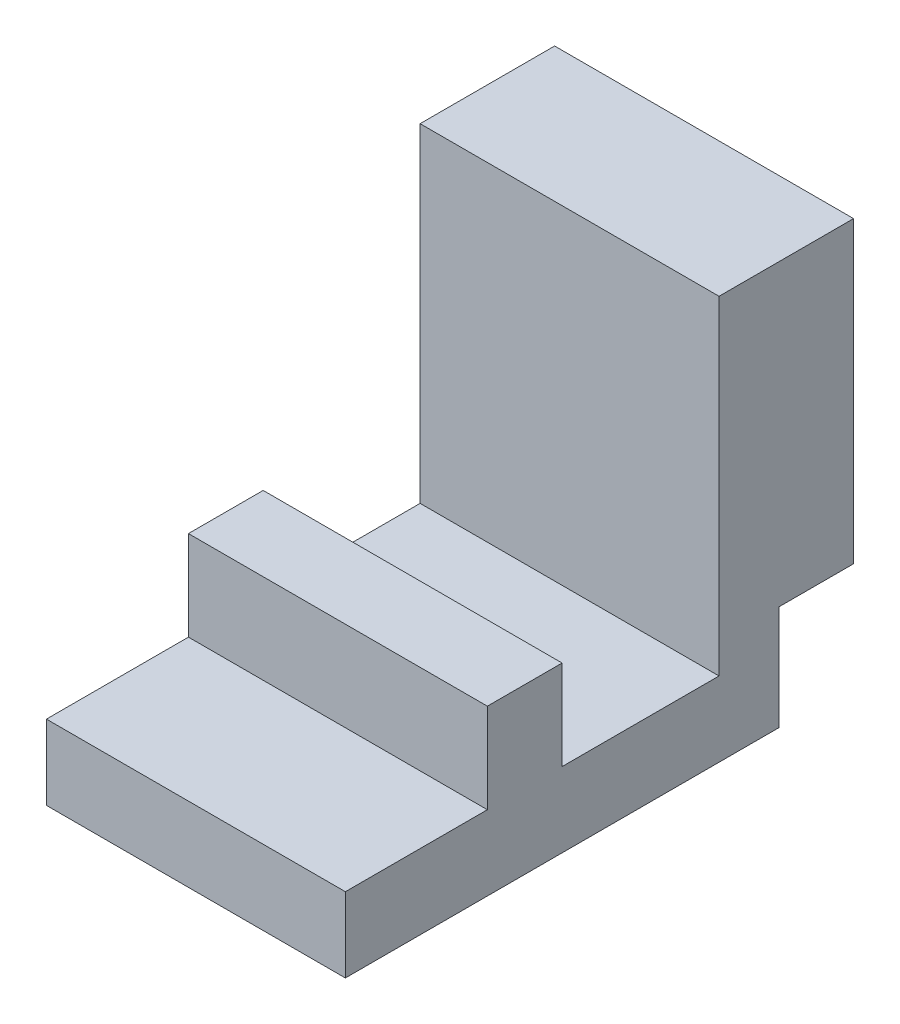
from build123d import *

# Parameters (mm, degrees)
SALIENTE_EXTRUIR2_DEPTH = 20


with BuildPart() as part:
    # Croquis1 → Saliente-Extruir2 (new, symmetric)
    with BuildSketch(Plane(origin=(0, 0, 0), x_dir=(0, 0, -1), z_dir=(1, 0, 0))):
        Polygon((0, 0), (0, 14), (10, 14), (10, 54), (-8, 54), (-8, 10), (-29, 10), (-29, 22), (-39, 22), (-39, 10), (-58, 10), (-58, 0), align=None)
    extrude(amount=SALIENTE_EXTRUIR2_DEPTH, both=True)


solid = part.part
